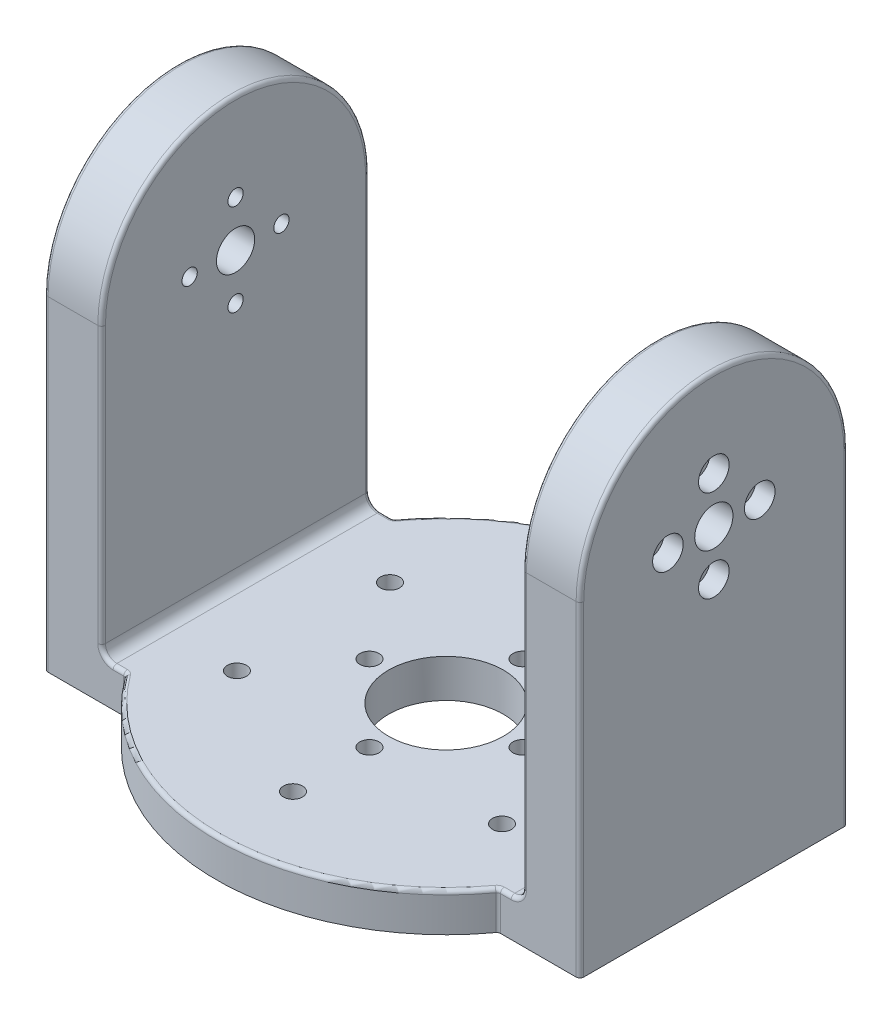
from build123d import *

# Parameters (mm, degrees)
SKETCH1_R                      = 5
BOSS_EXTRUDE1_DEPTH            = 70
CUT_EXTRUDE1_DEPTH             = 144.265487819
CUT_EXTRUDE1_DEPTH_BACK        = 144.265487819
SKETCH2_W                      = 110
SKETCH2_H                      = 110
SKETCH10_R                     = 60
BOSS_EXTRUDE3_DEPTH            = 10
CUT_EXTRUDE5_DEPTH             = 144.527000944
CUT_EXTRUDE5_DEPTH_BACK        = 144.527000944
SKETCH6_R                      = 15
CUT_EXTRUDE6_REACH             = 195.907
SKETCH7_R                      = 2
CUT_EXTRUDE6_DIRECTION_2_DEPTH = 194.907194297
SKETCH8_R                      = 4
CUT_EXTRUDE7_DEPTH             = 5
CIRPATTERN1_COUNT              = 4
MIRROR2_COPY_1_REACH           = 195.907
MIRROR2_COPY_1_SKETCH_R        = 2
MIRROR2_COPY_2_REACH           = 195.907
MIRROR2_COPY_2_SKETCH_R        = 2
MIRROR2_COPY_3_REACH           = 195.907
MIRROR2_COPY_3_SKETCH_R        = 2
MIRROR2_COPY_4_SKETCH_R        = 2
MIRROR2_COPY_4_DEPTH           = 194.907194297
MIRROR2_COPY_5_SKETCH_R        = 2
MIRROR2_COPY_5_DEPTH           = 194.907194297
MIRROR2_COPY_6_SKETCH_R        = 2
MIRROR2_COPY_6_DEPTH           = 194.907194297
MIRROR2_COPY_7_SKETCH_R        = 4
MIRROR2_COPY_7_DEPTH           = 5
MIRROR2_COPY_8_SKETCH_R        = 4
MIRROR2_COPY_8_DEPTH           = 5
MIRROR2_COPY_9_SKETCH_R        = 4
MIRROR2_COPY_9_DEPTH           = 5
MIRROR2_COPY_10_SKETCH_R       = 2
MIRROR2_COPY_10_DEPTH          = 194.907194297
SKETCH11_R                     = 1.7
CUT_EXTRUDE8_DEPTH             = 144.527000944
SKETCH12_R                     = 2.5
CUT_EXTRUDE9_DEPTH             = 5
CIRPATTERN2_COUNT              = 6
SKETCH13_R                     = 1.7
CUT_EXTRUDE10_DEPTH            = 144.527000944
SKETCH14_R                     = 2.5
CUT_EXTRUDE11_DEPTH            = 5
CIRPATTERN3_COUNT              = 4
FILLET2_R                      = 3
FILLET1_R                      = 1


with BuildPart() as part:
    # Sketch1 → Boss-Extrude1 (new, symmetric)
    with BuildSketch(Plane(origin=(0, 0, 0), x_dir=(0, 0, -1), z_dir=(1, 0, 0))):
        with BuildLine():
            Line((-35, 0), (35, 0))
            Line((35, 0), (35, 85))
            ThreePointArc((35, 85), (24.748737342, 109.748737342), (0, 120))
            ThreePointArc((0, 120), (-24.748737342, 109.748737342), (-35, 85))
            Line((-35, 85), (-35, 0))
        make_face()
        with Locations((0, 85)):
            Circle(SKETCH1_R, mode=Mode.SUBTRACT)
    extrude(amount=BOSS_EXTRUDE1_DEPTH, both=True)

    # Sketch2 → Cut-Extrude1 (cut, two sides: drawn at the far end of the back side and taken through both)
    with BuildSketch(Plane.XY.offset(-CUT_EXTRUDE1_DEPTH_BACK)):
        with Locations((0, 65)):
            Rectangle(SKETCH2_W, SKETCH2_H)
    extrude(amount=CUT_EXTRUDE1_DEPTH + CUT_EXTRUDE1_DEPTH_BACK, mode=Mode.SUBTRACT)

    # Sketch10 → Boss-Extrude3 (add)
    with BuildSketch(Plane.XZ):
        Circle(SKETCH10_R)
    extrude(amount=-BOSS_EXTRUDE3_DEPTH)

    # Sketch6 → Cut-Extrude5 (cut, two sides: drawn at the far end of the back side and taken through both)
    with BuildSketch(Plane(origin=(0, 10, 0), x_dir=(1, 0, 0), z_dir=(0, 1, 0)).offset(-CUT_EXTRUDE5_DEPTH_BACK)):
        with Locations(Location((0, 0, 0), (0, 0, 270))):
            Circle(SKETCH6_R)
    extrude(amount=CUT_EXTRUDE5_DEPTH + CUT_EXTRUDE5_DEPTH_BACK, mode=Mode.SUBTRACT)

    # Sketch7 → Cut-Extrude6 (cut, up to next)
    with BuildSketch(Plane(origin=(70, 0, 0), x_dir=(0, 0, -1), z_dir=(1, 0, 0)), mode=Mode.PRIVATE) as cut_extrude6_sk1:
        with Locations(Location((0, 73, 0), (0, 0, 180))):
            Circle(SKETCH7_R)
    cut_extrude6_tool1 = extrude(cut_extrude6_sk1.sketch, amount=-CUT_EXTRUDE6_REACH, mode=Mode.PRIVATE) & part.part
    cut_extrude6 = cut_extrude6_tool1.solids().sort_by_distance((70, 73, 0))[0]
    add(cut_extrude6, mode=Mode.SUBTRACT)

    # Sketch7 → Cut-Extrude6 direction 2 (cut)
    with BuildSketch(Plane(origin=(70, 0, 0), x_dir=(0, 0, -1), z_dir=(1, 0, 0))):
        with Locations(Location((0, 73, 0), (0, 0, 180))):
            Circle(SKETCH7_R)
    cut_extrude6_direction_2 = extrude(amount=CUT_EXTRUDE6_DIRECTION_2_DEPTH, mode=Mode.SUBTRACT)

    # Sketch8 → Cut-Extrude7 (cut)
    with BuildSketch(Plane.ZY.offset(-70)):
        with Locations((0, 73)):
            Circle(SKETCH8_R)
    cut_extrude7 = extrude(amount=CUT_EXTRUDE7_DEPTH, mode=Mode.SUBTRACT)

    # CirPattern1: Cut-Extrude6, Cut-Extrude6 direction 2, Cut-Extrude7 ×4 about axis
    cirpattern1_axis = Axis((0, 85, 0), (1, 0, 0))
    add([cut_extrude6.rotate(cirpattern1_axis, i * 360 / CIRPATTERN1_COUNT) for i in range(1, CIRPATTERN1_COUNT)], mode=Mode.SUBTRACT)
    add([cut_extrude6_direction_2.rotate(cirpattern1_axis, i * 360 / CIRPATTERN1_COUNT) for i in range(1, CIRPATTERN1_COUNT)], mode=Mode.SUBTRACT)
    add([cut_extrude7.rotate(cirpattern1_axis, i * 360 / CIRPATTERN1_COUNT) for i in range(1, CIRPATTERN1_COUNT)], mode=Mode.SUBTRACT)

    # Mirror2: Cut-Extrude6, Cut-Extrude6 direction 2, Cut-Extrude7 across plane
    add(cut_extrude6.mirror(Plane(origin=(0, 0, 0), x_dir=(0, 0, 1), z_dir=(1, 0, 0))), mode=Mode.SUBTRACT)
    add(cut_extrude6_direction_2.mirror(Plane(origin=(0, 0, 0), x_dir=(0, 0, 1), z_dir=(1, 0, 0))), mode=Mode.SUBTRACT)
    add(cut_extrude7.mirror(Plane(origin=(0, 0, 0), x_dir=(0, 0, 1), z_dir=(1, 0, 0))), mode=Mode.SUBTRACT)

    # Mirror2 copy 1 sketch → Mirror2 copy 1 (cut, up to next)
    with BuildSketch(Plane(origin=(-70, 85, -85), x_dir=(0, 1, 0), z_dir=(-1, 0, 0)), mode=Mode.PRIVATE) as mirror2_copy_1_sk1:
        with Locations((0, -73)):
            Circle(MIRROR2_COPY_1_SKETCH_R)
    mirror2_copy_1_tool1 = extrude(mirror2_copy_1_sk1.sketch, amount=-MIRROR2_COPY_1_REACH, mode=Mode.PRIVATE) & part.part
    add(mirror2_copy_1_tool1.solids().sort_by_distance((-70, 85, -12))[0], mode=Mode.SUBTRACT)

    # Mirror2 copy 2 sketch → Mirror2 copy 2 (cut, up to next)
    with BuildSketch(Plane(origin=(-70, 170, 0), x_dir=(0, 0, 1), z_dir=(-1, 0, 0)), mode=Mode.PRIVATE) as mirror2_copy_2_sk1:
        with Locations((0, -73)):
            Circle(MIRROR2_COPY_2_SKETCH_R)
    mirror2_copy_2_tool1 = extrude(mirror2_copy_2_sk1.sketch, amount=-MIRROR2_COPY_2_REACH, mode=Mode.PRIVATE) & part.part
    add(mirror2_copy_2_tool1.solids().sort_by_distance((-70, 97, 0))[0], mode=Mode.SUBTRACT)

    # Mirror2 copy 3 sketch → Mirror2 copy 3 (cut, up to next)
    with BuildSketch(Plane(origin=(-70, 85, 85), x_dir=(0, -1, 0), z_dir=(-1, 0, 0)), mode=Mode.PRIVATE) as mirror2_copy_3_sk1:
        with Locations((0, -73)):
            Circle(MIRROR2_COPY_3_SKETCH_R)
    mirror2_copy_3_tool1 = extrude(mirror2_copy_3_sk1.sketch, amount=-MIRROR2_COPY_3_REACH, mode=Mode.PRIVATE) & part.part
    add(mirror2_copy_3_tool1.solids().sort_by_distance((-70, 85, 12))[0], mode=Mode.SUBTRACT)

    # Mirror2 copy 4 sketch → Mirror2 copy 4 (cut)
    with BuildSketch(Plane(origin=(-70, 85, -85), x_dir=(0, 1, 0), z_dir=(-1, 0, 0))):
        with Locations((0, -73)):
            Circle(MIRROR2_COPY_4_SKETCH_R)
    extrude(amount=MIRROR2_COPY_4_DEPTH, mode=Mode.SUBTRACT)

    # Mirror2 copy 5 sketch → Mirror2 copy 5 (cut)
    with BuildSketch(Plane(origin=(-70, 170, 0), x_dir=(0, 0, 1), z_dir=(-1, 0, 0))):
        with Locations((0, -73)):
            Circle(MIRROR2_COPY_5_SKETCH_R)
    extrude(amount=MIRROR2_COPY_5_DEPTH, mode=Mode.SUBTRACT)

    # Mirror2 copy 6 sketch → Mirror2 copy 6 (cut)
    with BuildSketch(Plane(origin=(-70, 85, 85), x_dir=(0, -1, 0), z_dir=(-1, 0, 0))):
        with Locations((0, -73)):
            Circle(MIRROR2_COPY_6_SKETCH_R)
    extrude(amount=MIRROR2_COPY_6_DEPTH, mode=Mode.SUBTRACT)

    # Mirror2 copy 7 sketch → Mirror2 copy 7 (cut)
    with BuildSketch(Plane(origin=(-70, 85, -85), x_dir=(0, -1, 0), z_dir=(1, 0, 0))):
        with Locations((0, -73)):
            Circle(MIRROR2_COPY_7_SKETCH_R)
    extrude(amount=MIRROR2_COPY_7_DEPTH, mode=Mode.SUBTRACT)

    # Mirror2 copy 8 sketch → Mirror2 copy 8 (cut)
    with BuildSketch(Plane(origin=(-70, 170, 0), x_dir=(0, 0, -1), z_dir=(1, 0, 0))):
        with Locations((0, -73)):
            Circle(MIRROR2_COPY_8_SKETCH_R)
    extrude(amount=MIRROR2_COPY_8_DEPTH, mode=Mode.SUBTRACT)

    # Mirror2 copy 9 sketch → Mirror2 copy 9 (cut)
    with BuildSketch(Plane(origin=(-70, 85, 85), x_dir=(0, 1, 0), z_dir=(1, 0, 0))):
        with Locations((0, -73)):
            Circle(MIRROR2_COPY_9_SKETCH_R)
    extrude(amount=MIRROR2_COPY_9_DEPTH, mode=Mode.SUBTRACT)

    # Mirror2 copy 10 sketch → Mirror2 copy 10 (cut)
    with BuildSketch(Plane(origin=(-70, 0, 0), x_dir=(0, 0, -1), z_dir=(-1, 0, 0))):
        with Locations((0, -73)):
            Circle(MIRROR2_COPY_10_SKETCH_R)
    extrude(amount=MIRROR2_COPY_10_DEPTH, mode=Mode.SUBTRACT)

    # Sketch11 → Cut-Extrude8 (cut, symmetric)
    with BuildSketch(Plane(origin=(0, 10, 0), x_dir=(1, 0, 0), z_dir=(0, 1, 0))):
        with Locations(Location((0, -40, 0), (0, 0, 270))):
            Circle(SKETCH11_R)
    cut_extrude8 = extrude(amount=CUT_EXTRUDE8_DEPTH, both=True, mode=Mode.SUBTRACT)

    # Sketch12 → Cut-Extrude9 (cut)
    with BuildSketch(Plane(origin=(0, 10, 0), x_dir=(1, 0, 0), z_dir=(0, 1, 0))):
        with Locations(Location((0, -40, 0), (0, 0, 270))):
            Circle(SKETCH12_R)
    cut_extrude9 = extrude(amount=-CUT_EXTRUDE9_DEPTH, mode=Mode.SUBTRACT)

    # CirPattern2: Cut-Extrude8, Cut-Extrude9 ×6 about axis
    cirpattern2_axis = Axis((0, 0, 0), (0, 1, 0))
    add([cut_extrude8.rotate(cirpattern2_axis, i * 360 / CIRPATTERN2_COUNT) for i in range(1, CIRPATTERN2_COUNT)], mode=Mode.SUBTRACT)
    add([cut_extrude9.rotate(cirpattern2_axis, i * 360 / CIRPATTERN2_COUNT) for i in range(1, CIRPATTERN2_COUNT)], mode=Mode.SUBTRACT)

    # Sketch13 → Cut-Extrude10 (cut, symmetric)
    with BuildSketch(Plane(origin=(0, 10, 0), x_dir=(1, 0, 0), z_dir=(0, 1, 0))):
        with Locations(Location((0, -20, 0), (0, 0, 270))):
            Circle(SKETCH13_R)
    cut_extrude10 = extrude(amount=CUT_EXTRUDE10_DEPTH, both=True, mode=Mode.SUBTRACT)

    # Sketch14 → Cut-Extrude11 (cut)
    with BuildSketch(Plane(origin=(0, 10, 0), x_dir=(1, 0, 0), z_dir=(0, 1, 0))):
        with Locations(Location((0, -20, 0), (0, 0, 270))):
            Circle(SKETCH14_R)
    cut_extrude11 = extrude(amount=-CUT_EXTRUDE11_DEPTH, mode=Mode.SUBTRACT)

    # CirPattern3: Cut-Extrude10, Cut-Extrude11 ×4 about axis
    cirpattern3_axis = Axis((0, 0, 0), (0, 1, 0))
    add([cut_extrude10.rotate(cirpattern3_axis, i * 360 / CIRPATTERN3_COUNT) for i in range(1, CIRPATTERN3_COUNT)], mode=Mode.SUBTRACT)
    add([cut_extrude11.rotate(cirpattern3_axis, i * 360 / CIRPATTERN3_COUNT) for i in range(1, CIRPATTERN3_COUNT)], mode=Mode.SUBTRACT)

    # Fillet2
    fillet2_edges = [part.edges().sort_by_distance(p)[0] for p in [
        (-55, 10, 0),
        (55, 10, 0),
    ]]
    fillet(fillet2_edges, radius=FILLET2_R)

    # Fillet1
    fillet1_edges = [part.edges().sort_by_distance(p)[0] for p in [
        (70, 42.5, 35),
        (70, 42.5, -35),
        (-50.366985862, 10, 35),
        (-50.366985862, 10, -35),
        (55, 49, -35),
        (55, 49, 35),
        (-54.121320344, 10.878679656, 35),
        (-54.121320344, 10.878679656, -35),
        (54.121320344, 10.878679656, 35),
        (54.121320344, 10.878679656, -35),
        (-55, 49, 35),
        (-55, 120, 0),
        (-55, 49, -35),
        (55, 120, 0),
        (50.366985862, 10, -35),
        (70, 120, 0),
        (50.366985862, 10, 35),
        (0, 10, 60),
        (-70, 42.5, -35),
        (48.733971724, 5, 35),
        (48.733971724, 5, -35),
        (0, 10, -60),
        (-48.733971724, 5, 35),
        (-48.733971724, 5, -35),
        (-70, 42.5, 35),
        (-70, 120, 0),
    ]]
    fillet(fillet1_edges, radius=FILLET1_R)


solid = part.part
